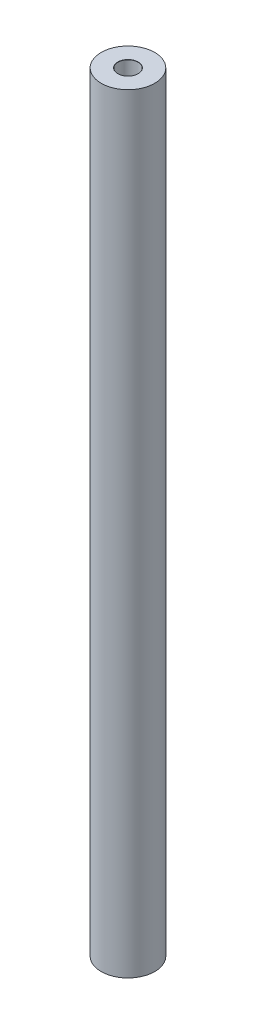
from build123d import *

# Parameters (mm, degrees)
SKETCH2_R           = 4
BOSS_EXTRUDE1_DEPTH = 115


with BuildPart() as part:
    # Sketch2 → Boss-Extrude1 (new body)
    with BuildSketch(Plane(origin=(0, 0, 0), x_dir=(1, 0, 0), z_dir=(0, 1, 0))):
        with Locations(Location((0, 0, 0), (0, 0, 270))):
            Circle(SKETCH2_R)
    extrude(amount=BOSS_EXTRUDE1_DEPTH)

    # Sketch5 → Ø3.0mm Dowel Hole1 (revolve, cut)
    with BuildSketch(Plane(origin=(0, 115, 0), x_dir=(0, 0, 1), z_dir=(1, 0, 0))):
        Polygon((0, 0), (0, 15.901290929), (1.5, 15), (1.5, 0.025), (1.525, 0), align=None)
    f_3_0mm_dowel_hole1 = revolve(axis=Axis((0, 121.35, 0), (0, -1, 0)), mode=Mode.SUBTRACT)

    # Mirror1: Ø3.0mm Dowel Hole1 across plane
    add(f_3_0mm_dowel_hole1.mirror(Plane.ZX.offset(57.5)), mode=Mode.SUBTRACT)


solid = part.part
